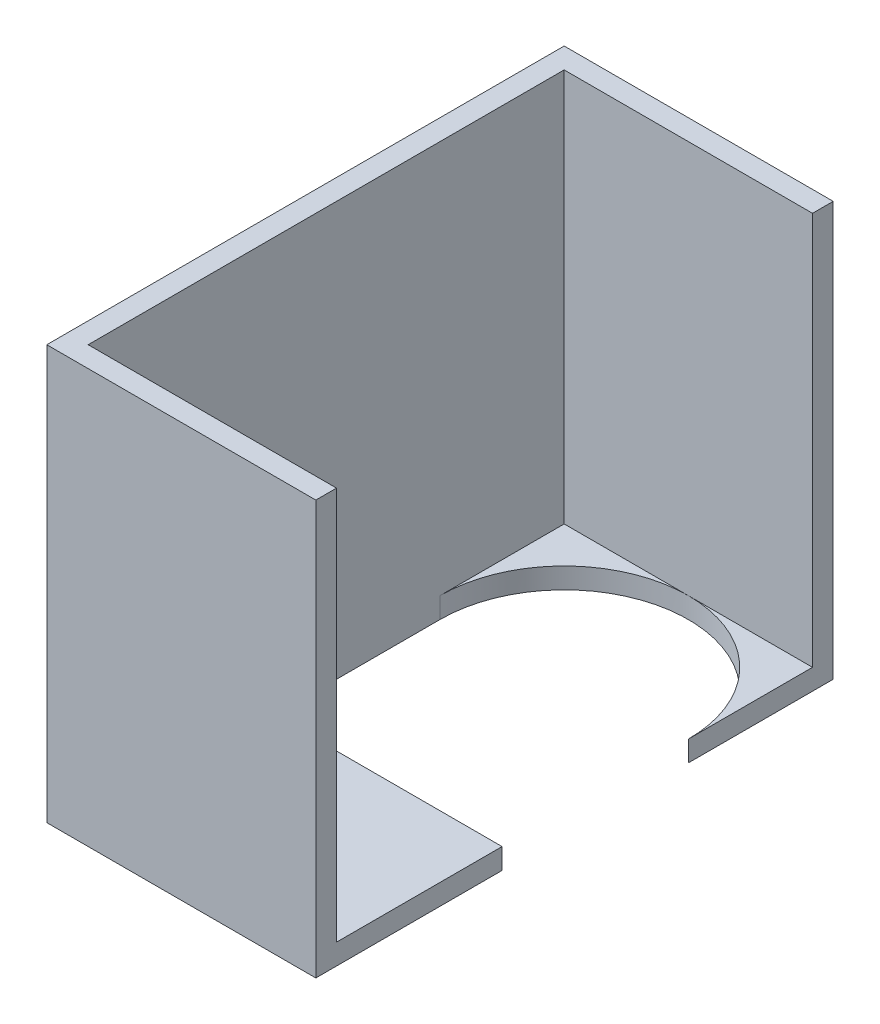
from build123d import *

# Parameters (mm, degrees)
SKETCH_15_W          = 13
SKETCH_15_H          = 25
EXTRUDE_4_DEPTH      = 20
CUT_EXTRUDE_START    = 1
SKETCH_16_W          = 12
SKETCH_16_H          = 23
CUT_EXTRUDE_47_DEPTH = 24.6018292
CUT_EXTRUDE_48_DEPTH = 25.6018292


with BuildPart() as part:
    # 스케치15 → 보스-돌출4 (new body)
    with BuildSketch(Plane(origin=(0, 0, 0), x_dir=(1, 0, 0), z_dir=(0, 1, 0))):
        with Locations((0.5, 0)):
            Rectangle(SKETCH_15_W, SKETCH_15_H)
    extrude(amount=EXTRUDE_4_DEPTH)

    # 스케치16 → 컷-돌출47 (cut, through all)
    with BuildSketch(Plane(origin=(0, 0, 0), x_dir=(1, 0, 0), z_dir=(0, 1, 0)).offset(CUT_EXTRUDE_START)):
        with Locations((1, 0)):
            Rectangle(SKETCH_16_W, SKETCH_16_H)
    extrude(amount=CUT_EXTRUDE_47_DEPTH, mode=Mode.SUBTRACT)

    # 스케치17 → 컷-돌출48 (cut, through all)
    with BuildSketch(Plane(origin=(0, 0, 0), x_dir=(1, 0, 0), z_dir=(0, 1, 0))):
        with BuildLine():
            Line((-5, -3.5), (7, -3.5))
            Line((7, -3.5), (7, 5.5))
            ThreePointArc((7, 5.5), (1, 11.5), (-5, 5.5))
            Line((-5, 5.5), (-5, -3.5))
        make_face()
    extrude(amount=CUT_EXTRUDE_48_DEPTH, mode=Mode.SUBTRACT)


solid = part.part
